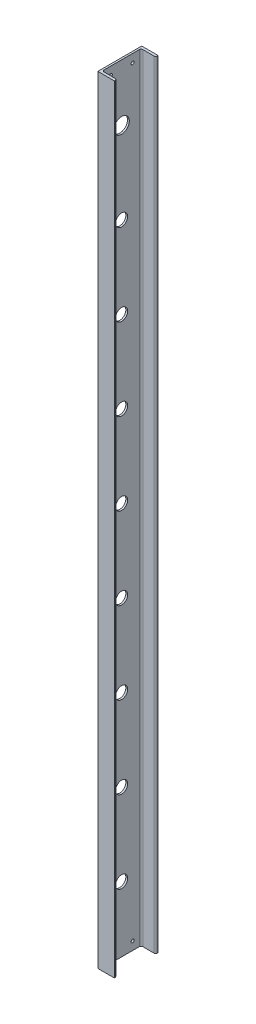
from build123d import *

# Parameters (mm, degrees)
BOSS_EXTRUDE1_DEPTH = 3540
SKETCH3_R           = 7
SKETCH3_R_2         = 7.5
CUT_EXTRUDE2_DEPTH  = 3540
SKETCH4_R           = 27.5
CUT_EXTRUDE3_DEPTH  = 3543.624331186
LPATTERN2_COUNT     = 9
LPATTERN2_PITCH     = 373
SKETCH6_R           = 35
CUT_EXTRUDE5_DEPTH  = 20


with BuildPart() as part:
    # Sketch1 → Boss-Extrude1 (new body)
    with BuildSketch(Plane(origin=(0, 0, 0), x_dir=(1, 0, 0), z_dir=(0, 1, 0))):
        with BuildLine():
            Line((-38.442622951, 80.983606557), (-113.442622951, 80.983606557))
            Line((-113.442622951, 80.983606557), (-113.442622951, -119.016393443))
            Line((-113.442622951, -119.016393443), (-38.442622951, -119.016393443))
            Line((-38.442622951, -119.016393443), (-38.442622951, -115.516393443))
            ThreePointArc((-38.442622951, -115.516393443), (-40.785768701, -109.859539193), (-46.442622951, -107.516393443))
            Line((-46.442622951, -107.516393443), (-96.942622951, -107.516393443))
            ThreePointArc((-96.942622951, -107.516393443), (-102.5994772, -105.173247692), (-104.942622951, -99.516393443))
            Line((-104.942622951, -99.516393443), (-104.942622951, 61.483606557))
            ThreePointArc((-104.942622951, 61.483606557), (-102.5994772, 67.140460807), (-96.942622951, 69.483606557))
            Line((-96.942622951, 69.483606557), (-46.442622951, 69.483606557))
            ThreePointArc((-46.442622951, 69.483606557), (-40.785768701, 71.826752308), (-38.442622951, 77.483606557))
            Line((-38.442622951, 77.483606557), (-38.442622951, 80.983606557))
        make_face()
    extrude(amount=BOSS_EXTRUDE1_DEPTH)

    # Sketch3 → Cut-Extrude2 (cut)
    with BuildSketch(Plane.ZY.offset(113.442622951)):
        with Locations((-30.983606557, 37.5)):
            Circle(SKETCH3_R)
        with Locations((69.016393443, 37.5)):
            Circle(SKETCH3_R_2)
    cut_extrude2 = extrude(amount=-CUT_EXTRUDE2_DEPTH, mode=Mode.SUBTRACT)

    # Mirror1: Cut-Extrude2 across plane
    add(cut_extrude2.mirror(Plane(origin=(0, 1770, 0), x_dir=(0, 0, 1), z_dir=(0, -1, 0))), mode=Mode.SUBTRACT)

    # Sketch4 → Cut-Extrude3 (cut, symmetric)
    with BuildSketch(Plane(origin=(-104.942622951, 0, 0), x_dir=(0, 0, -1), z_dir=(1, 0, 0))):
        with Locations((-19.016393443, 297)):
            Circle(SKETCH4_R)
    cut_extrude3 = extrude(amount=CUT_EXTRUDE3_DEPTH, both=True, mode=Mode.SUBTRACT)

    # LPattern2: Cut-Extrude3 ×9
    with Locations(*[(0, i * LPATTERN2_PITCH, 0) for i in range(1, LPATTERN2_COUNT)]):
        add(cut_extrude3, mode=Mode.SUBTRACT)

    # Sketch6 → Cut-Extrude5 (cut)
    with BuildSketch(Plane(origin=(-104.942622951, 0, 0), x_dir=(0, 0, -1), z_dir=(1, 0, 0))):
        with Locations((-19.016393443, 3281)):
            Circle(SKETCH6_R)
    extrude(amount=-CUT_EXTRUDE5_DEPTH, mode=Mode.SUBTRACT)


solid = part.part
